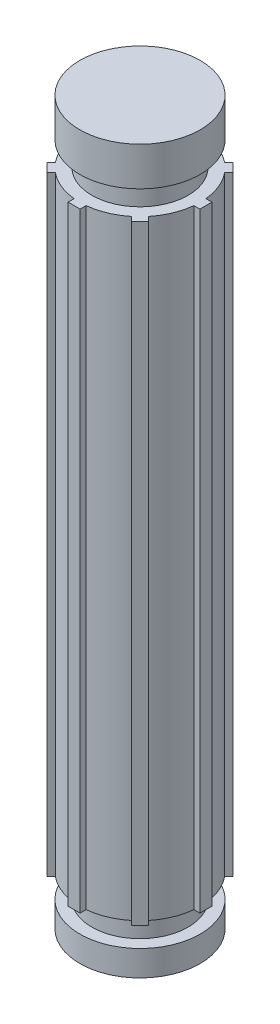
from build123d import *

# Parameters (mm, degrees)
BOSS_EXTRUDE2_START = -109.568605
BOSS_EXTRUDE2_DEPTH = 101.325087
CIRPATTERN1_COUNT   = 8


with BuildPart() as part:
    # Sketch3 → Revolve1 (revolve)
    with BuildSketch(Plane(origin=(0, 0, 0), x_dir=(0, 0, -1), z_dir=(1, 0, 0))):
        Polygon((0, 120), (0, 0), (10, 0), (10, 4.243518426), (8, 4.243518426), (8, 8.243518426), (10, 8.243518426), (10, 109.568605079), (8, 109.568605079), (8, 113.568605079), (10, 113.568605079), (10, 120), align=None)
    revolve(axis=Axis((0, 0, 0), (0, 1, 0)))

    # Sketch4 → Boss-Extrude2 (add)
    with BuildSketch(Plane.XZ.offset(BOSS_EXTRUDE2_START)):
        with BuildLine():
            Line((-1, 9.949874371), (-1, 10.949874371))
            Line((-1, 10.949874371), (1, 10.949874371))
            Line((1, 10.949874371), (1, 9.949874371))
            ThreePointArc((1, 9.949874371), (0, 10), (-1, 9.949874371))
        make_face()
    boss_extrude2 = extrude(amount=BOSS_EXTRUDE2_DEPTH)

    # CirPattern1: Boss-Extrude2 ×8 about axis
    cirpattern1_axis = Axis((0, 0, 0), (0, 1, 0))
    for i in range(1, CIRPATTERN1_COUNT):
        add(boss_extrude2.rotate(cirpattern1_axis, i * 360 / CIRPATTERN1_COUNT))


solid = part.part
